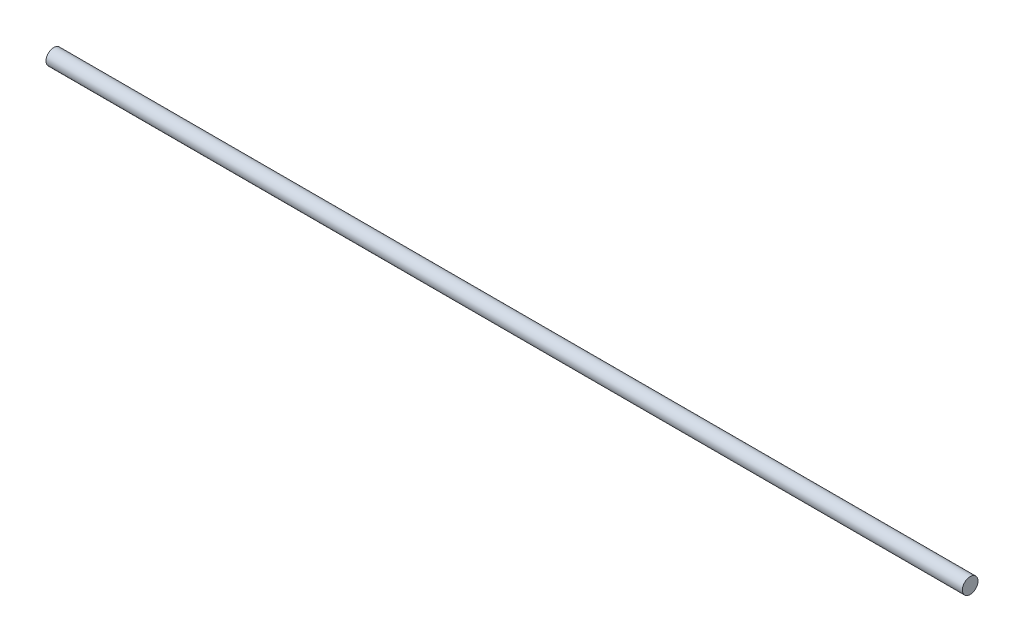
from build123d import *

# Parameters (mm, degrees)
SKETCH1_R           = 40
BOSS_EXTRUDE1_DEPTH = 4700


with BuildPart() as part:
    # Sketch1 → Boss-Extrude1 (new body)
    with BuildSketch(Plane(origin=(0, 0, 0), x_dir=(0, 0, -1), z_dir=(1, 0, 0))):
        Circle(SKETCH1_R)
    extrude(amount=BOSS_EXTRUDE1_DEPTH)


solid = part.part
